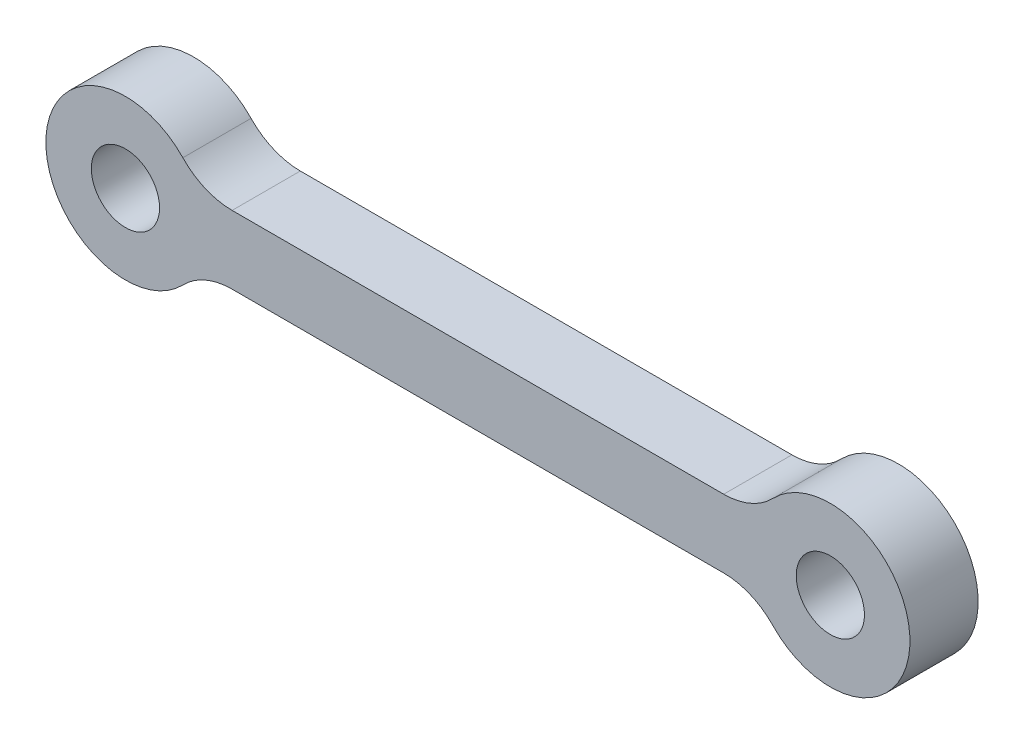
from build123d import *

# Parameters (mm, degrees)
SKETCH1_R           = 1.5
BOSS_EXTRUDE1_DEPTH = 3
FILLET1_R           = 3


with BuildPart() as part:
    # Sketch1 → Boss-Extrude1 (new body)
    with BuildSketch(Plane.XY):
        with BuildLine():
            Line((27.83772234, 1.5), (3.16227766, 1.5))
            ThreePointArc((3.16227766, 1.5), (-3.5, 0), (3.16227766, -1.5))
            Line((3.16227766, -1.5), (27.83772234, -1.5))
            ThreePointArc((27.83772234, -1.5), (34.5, 0), (27.83772234, 1.5))
        make_face()
        with Locations((31, 0)):
            Circle(SKETCH1_R, mode=Mode.SUBTRACT)
        Circle(SKETCH1_R, mode=Mode.SUBTRACT)
    extrude(amount=BOSS_EXTRUDE1_DEPTH)

    # Fillet1
    fillet1_edges = [part.edges().sort_by_distance(p)[0] for p in [
        (27.83772234, -1.5, 1.5),
        (3.16227766, -1.5, 1.5),
        (27.83772234, 1.5, 1.5),
        (3.16227766, 1.5, 1.5),
    ]]
    fillet(fillet1_edges, radius=FILLET1_R)


solid = part.part
